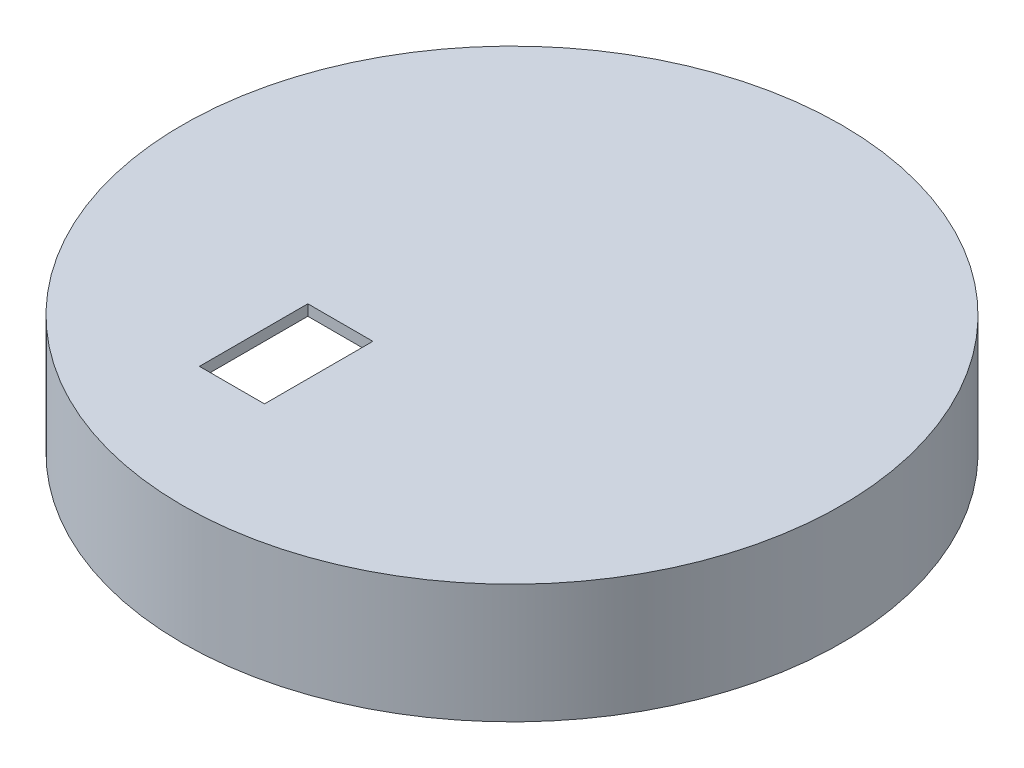
from build123d import *

# Parameters (mm, degrees)
SKIZZE1_R                       = 30.405
SKIZZE1_R_2                     = 28.405
AUFSATZ_LINEAR_AUSTRAGEN1_DEPTH = 10
SKIZZE2_R                       = 30.405
AUFSATZ_LINEAR_AUSTRAGEN2_DEPTH = 1
AUFSATZ_LINEAR_START            = 10
AUFSATZ_LINEAR_AUSTRAGEN3_DEPTH = 10
SKIZZE5_R                       = 1.5
SCHNITT_LINEAR_AUSTRAGEN2_DEPTH = 10
SKIZZE6_W                       = 6
SKIZZE6_H                       = 10
SCHNITT_LINEAR_AUSTRAGEN3_DEPTH = 10


with BuildPart() as part:
    # Skizze1 → Aufsatz-Linear austragen1 (new body)
    with BuildSketch(Plane(origin=(0, 0, 0), x_dir=(1, 0, 0), z_dir=(0, 1, 0))):
        with Locations(Location((0, 0, 0), (0, 0, 270))):
            Circle(SKIZZE1_R)
        with Locations(Location((0, 0, 0), (0, 0, 270))):
            Circle(SKIZZE1_R_2, mode=Mode.SUBTRACT)
    extrude(amount=AUFSATZ_LINEAR_AUSTRAGEN1_DEPTH)

    # Skizze2 → Aufsatz-Linear austragen2 (add)
    with BuildSketch(Plane(origin=(0, 10, 0), x_dir=(1, 0, 0), z_dir=(0, 1, 0))):
        with Locations(Location((0, 0, 0), (0, 0, 270))):
            Circle(SKIZZE2_R)
    extrude(amount=AUFSATZ_LINEAR_AUSTRAGEN2_DEPTH)

    # Skizze4 → Aufsatz-Linear austragen3 (add)
    with BuildSketch(Plane.XZ.offset(-10).offset(AUFSATZ_LINEAR_START)):
        with BuildLine():
            ThreePointArc((-28.126789531, -3.965820935), (-23.605, 0), (-28.126789531, 3.965820935))
            ThreePointArc((-28.126789531, 3.965820935), (-28.405, 0), (-28.126789531, -3.965820935))
        make_face()
        with BuildLine():
            ThreePointArc((28.405, 0), (28.33536202, 1.987783738), (28.126789531, 3.965820935))
            ThreePointArc((28.126789531, 3.965820935), (23.605, 0), (28.126789531, -3.965820935))
            ThreePointArc((28.126789531, -3.965820935), (28.33536202, -1.987783738), (28.405, 0))
        make_face()
    extrude(amount=-AUFSATZ_LINEAR_AUSTRAGEN3_DEPTH)

    # Skizze5 → Schnitt-Linear austragen2 (cut)
    with BuildSketch(Plane.XZ):
        with Locations(Location((-27.605, 0, 0), (0, 0, 270))):
            Circle(SKIZZE5_R)
        with BuildLine():
            ThreePointArc((29.105, 0), (27.605, 1.5), (26.105, 0))
            Line((26.105, 0), (29.105, 0))
        make_face()
        with BuildLine():
            Line((29.105, 0), (26.105, 0))
            ThreePointArc((26.105, 0), (27.605, -1.5), (29.105, 0))
        make_face()
    extrude(amount=-SCHNITT_LINEAR_AUSTRAGEN2_DEPTH, mode=Mode.SUBTRACT)

    # Skizze6 → Schnitt-Linear austragen3 (cut)
    with BuildSketch(Plane(origin=(0, 11, 0), x_dir=(1, 0, 0), z_dir=(0, 1, 0))):
        with Locations((-7.328778972, -13.508309901)):
            Rectangle(SKIZZE6_W, SKIZZE6_H)
    extrude(amount=-SCHNITT_LINEAR_AUSTRAGEN3_DEPTH, mode=Mode.SUBTRACT)


solid = part.part
